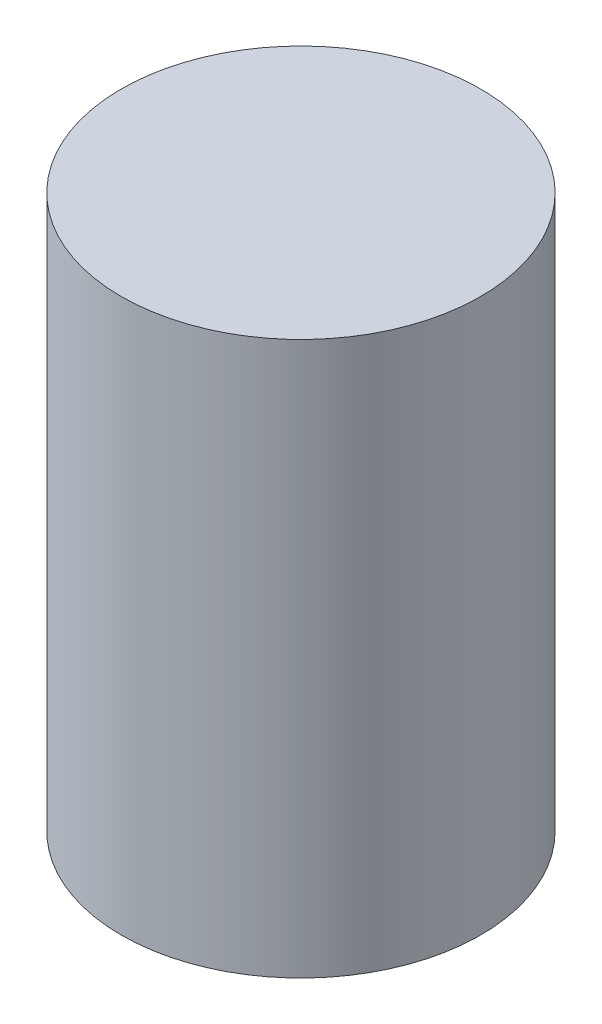
from build123d import *

# Parameters (mm, degrees)
SKETCH1_R           = 1.3
BOSS_EXTRUDE1_DEPTH = 4


with BuildPart() as part:
    # Sketch1 → Boss-Extrude1 (new body)
    with BuildSketch(Plane(origin=(0, 0, 0), x_dir=(1, 0, 0), z_dir=(0, 1, 0))):
        with Locations(Location((0, 0, 0), (0, 0, 270))):
            Circle(SKETCH1_R)
    extrude(amount=BOSS_EXTRUDE1_DEPTH)


solid = part.part
